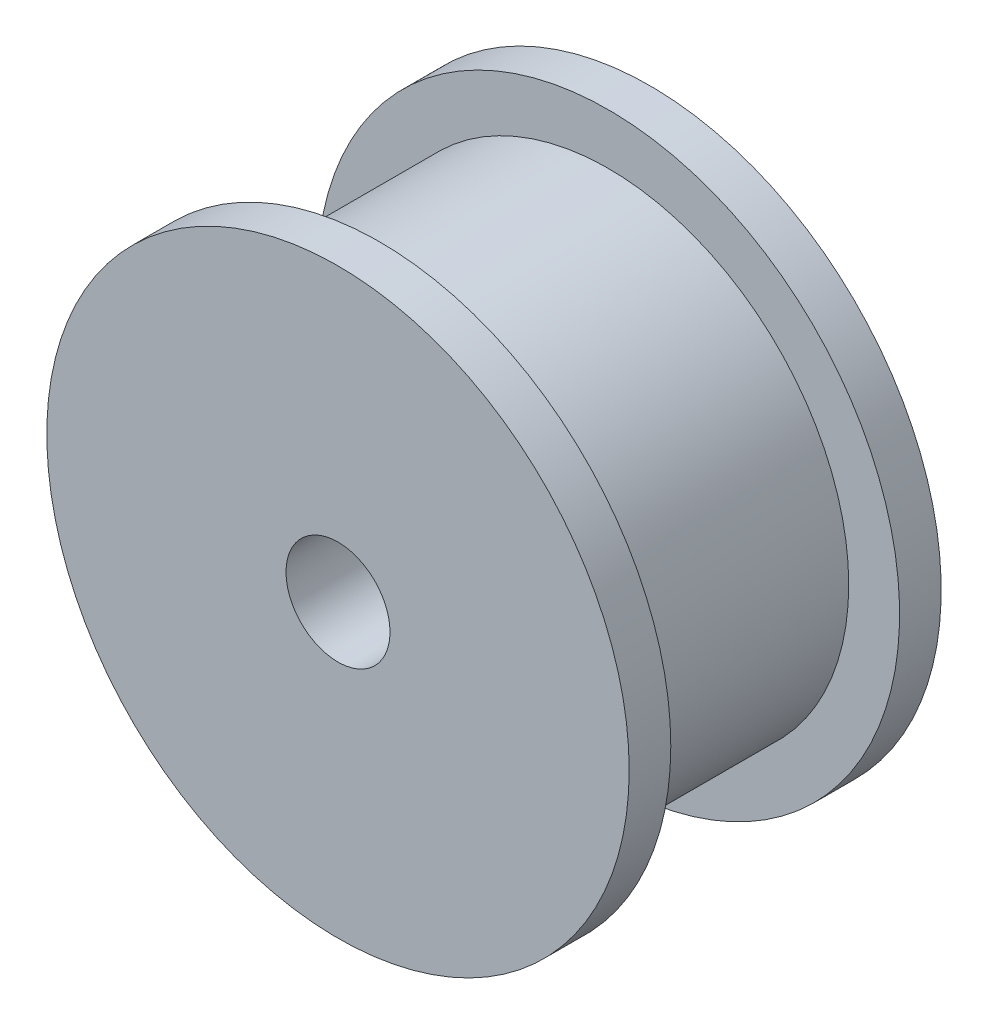
from build123d import *

# Parameters (mm, degrees)
SKETCH_1_R          = 11.555
EXTRUDE_1_DEPTH     = 11
SKETCH_2_R          = 14
EXTRUDE_2_DEPTH     = 2
EXTRUDE_START       = 2
SKETCH_3_R          = 14
EXTRUDE_3_DEPTH     = 2
SKETCH_4_R          = 2.5
CUT_EXTRUDE_1_DEPTH = 25.839484697


with BuildPart() as part:
    # 草图1 → 凸台-拉伸1 (new body)
    with BuildSketch(Plane.XY):
        Circle(SKETCH_1_R)
    extrude(amount=EXTRUDE_1_DEPTH)

    # 草图2 → 凸台-拉伸2 (add)
    with BuildSketch(Plane.XY.offset(11)):
        Circle(SKETCH_2_R)
    extrude(amount=EXTRUDE_2_DEPTH)

    # 草图3 → 凸台-拉伸3 (add)
    with BuildSketch(Plane(origin=(0, 0, 0), x_dir=(-1, 0, 0), z_dir=(0, 0, -1)).offset(EXTRUDE_START)):
        with Locations(Location((0, 0, 0), (0, 0, 180))):
            Circle(SKETCH_3_R)
    extrude(amount=-EXTRUDE_3_DEPTH)

    # 草图4 → 切除-拉伸1 (cut, through all)
    with BuildSketch(Plane(origin=(0, 0, -2), x_dir=(-1, 0, 0), z_dir=(0, 0, -1))):
        Circle(SKETCH_4_R)
    extrude(amount=-CUT_EXTRUDE_1_DEPTH, mode=Mode.SUBTRACT)


solid = part.part
